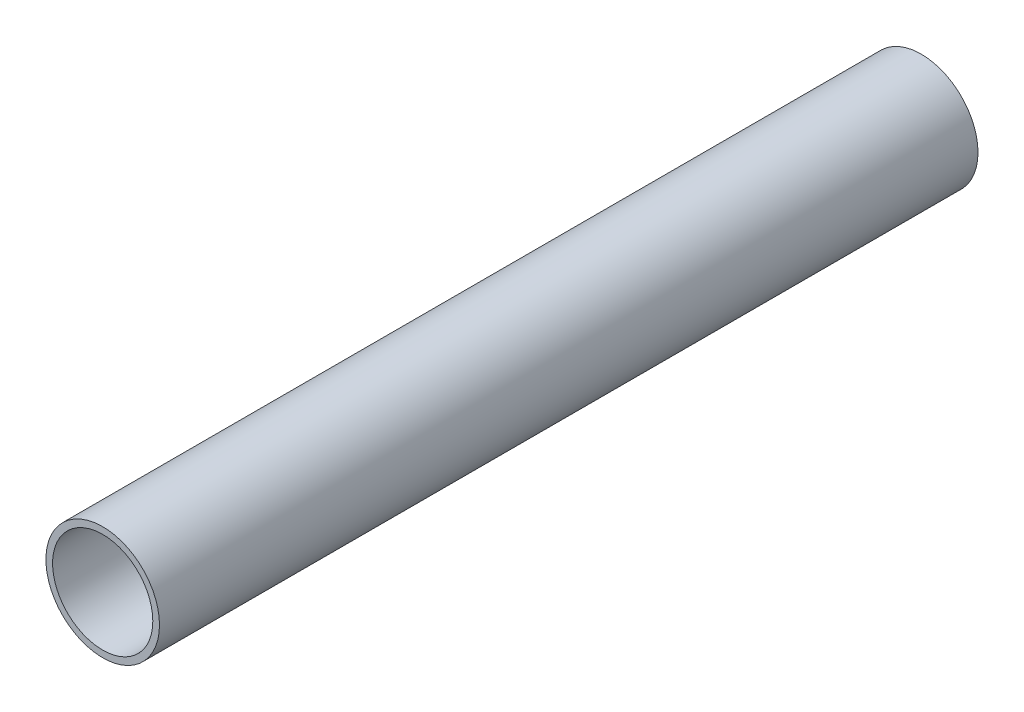
from build123d import *

# Parameters (mm, degrees)
SKETCH1_R           = 17
SKETCH1_R_2         = 15
BOSS_EXTRUDE1_DEPTH = 122.5


with BuildPart() as part:
    # Sketch1 → Boss-Extrude1 (new, symmetric)
    with BuildSketch(Plane.XY):
        Circle(SKETCH1_R)
        Circle(SKETCH1_R_2, mode=Mode.SUBTRACT)
    extrude(amount=BOSS_EXTRUDE1_DEPTH, both=True)


solid = part.part
